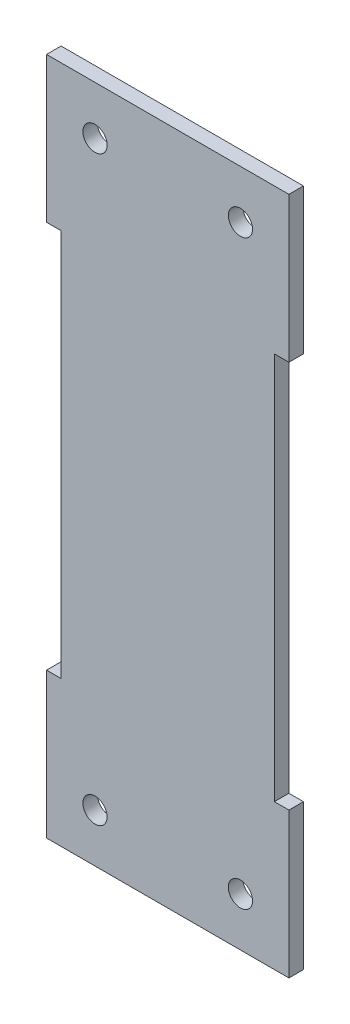
from build123d import *

# Parameters (mm, degrees)
SKETCH1_R           = 2.5
BOSS_EXTRUDE1_DEPTH = 3


with BuildPart() as part:
    # Sketch1 → Boss-Extrude1 (new body)
    with BuildSketch(Plane.XY):
        Polygon((25, -70), (-25, -70), (-25, -40), (-22, -40), (-22, 40), (-25, 40), (-25, 70), (25, 70), (25, 40), (22, 40), (22, -40), (25, -40), align=None)
        with Locations((-15, 60)):
            Circle(SKETCH1_R, mode=Mode.SUBTRACT)
        with Locations((15, 60)):
            Circle(SKETCH1_R, mode=Mode.SUBTRACT)
        with Locations(Location((15, -60, 0), (0, 0, 180))):
            Circle(SKETCH1_R, mode=Mode.SUBTRACT)
        with Locations(Location((-15, -60, 0), (0, 0, 180))):
            Circle(SKETCH1_R, mode=Mode.SUBTRACT)
    extrude(amount=BOSS_EXTRUDE1_DEPTH)


solid = part.part
